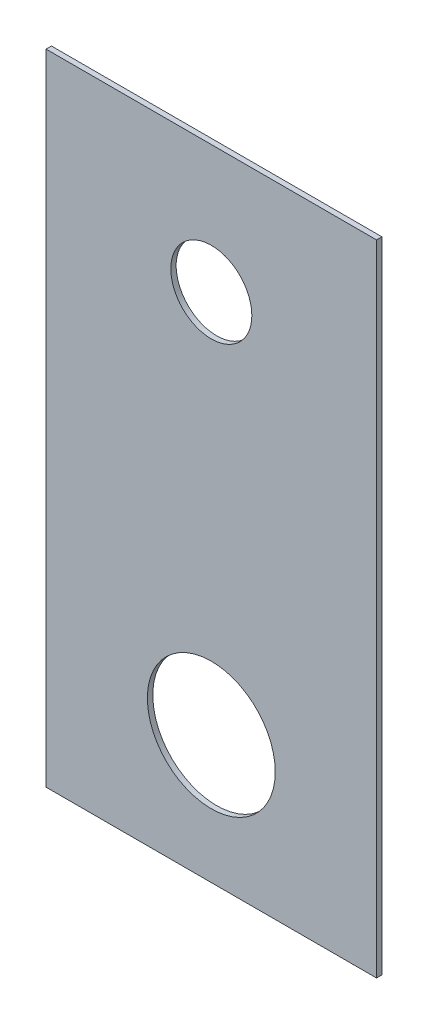
from build123d import *

# Parameters (mm, degrees)
SKETCH1_W           = 65.659
SKETCH1_H           = 127
SKETCH1_R           = 8.0518
SKETCH1_R_2         = 12.7
BOSS_EXTRUDE1_DEPTH = 1.068349106


with BuildPart() as part:
    # Sketch1 → Boss-Extrude1 (new body)
    with BuildSketch(Plane.XY):
        with Locations((32.8295, 63.5)):
            Rectangle(SKETCH1_W, SKETCH1_H)
        with Locations((32.8295, 101.6)):
            Circle(SKETCH1_R, mode=Mode.SUBTRACT)
        with Locations((32.8295, 25.4)):
            Circle(SKETCH1_R_2, mode=Mode.SUBTRACT)
    extrude(amount=BOSS_EXTRUDE1_DEPTH)


solid = part.part
